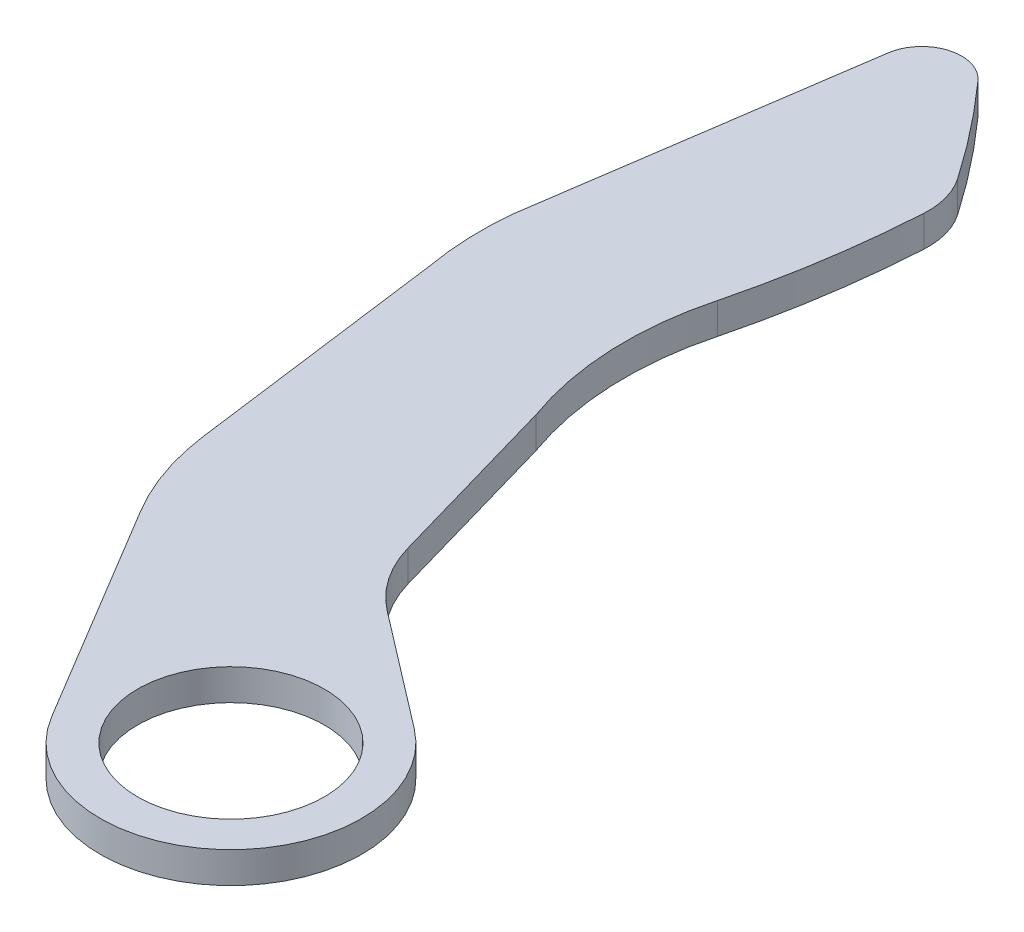
from build123d import *

# Parameters (mm, degrees)
SKETCH1_R           = 15
BOSS_EXTRUDE2_DEPTH = 5


with BuildPart() as part:
    # Sketch1 → Boss-Extrude2 (new body)
    with BuildSketch(Plane(origin=(0, 0, 0), x_dir=(1, 0, 0), z_dir=(0, 1, 0))):
        with BuildLine():
            Line((12.766893669, 16.673524704), (-5.806288098, 30.894983029))
            ThreePointArc((-5.806288098, 30.894983029), (-10.173884932, 35.51072238), (-12.873087905, 41.263569952))
            Line((-12.873087905, 41.263569952), (-21.139528525, 70.102189189))
            ThreePointArc((-21.139528525, 70.102189189), (-24.1253581, 85.250444887), (-22.456551163, 100.599709115))
            ThreePointArc((-22.456551163, 100.599709115), (-19.558480324, 114.843106453), (-18.020623668, 129.29676271))
            ThreePointArc((-18.020623668, 129.29676271), (-18.441772746, 133.226047543), (-20.116399197, 136.805470974))
            ThreePointArc((-20.116399197, 136.805470974), (-25.866377757, 144.615905974), (-32.098124488, 152.047627243))
            ThreePointArc((-32.098124488, 152.047627243), (-38.706331156, 153.910886754), (-43.194615771, 148.715173848))
            Line((-43.194615771, 148.715173848), (-50.932711484, 96.056215067))
            ThreePointArc((-50.932711484, 96.056215067), (-51.118515181, 89.191813761), (-50.383474997, 82.364351257))
            Line((-50.383474997, 82.364351257), (-44.824882263, 40.292034954))
            ThreePointArc((-44.824882263, 40.292034954), (-42.933064202, 32.343713579), (-39.465684055, 24.945601445))
            Line((-39.465684055, 24.945601445), (-18.005501401, -10.807493664))
            ThreePointArc((-18.005501401, -10.807493664), (13.987935708, -15.66325811), (12.766893669, 16.673524704))
        make_face()
        with Locations(Location((0, 0, 0), (0, 0, 270))):
            Circle(SKETCH1_R, mode=Mode.SUBTRACT)
    extrude(amount=BOSS_EXTRUDE2_DEPTH)


solid = part.part
